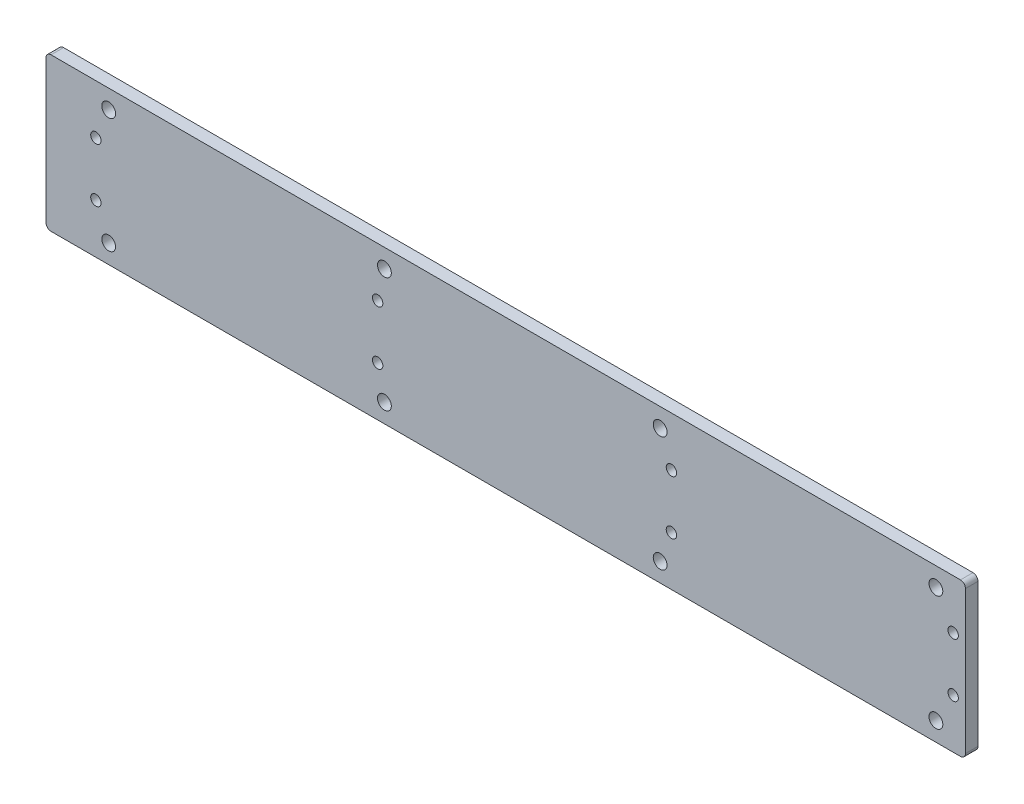
from build123d import *

# Parameters (mm, degrees)
SALIENTE_EXTRUIR1_DEPTH = 6.35
CROQUIS4_R              = 2.63125
CORTAR_EXTRUIR2_DEPTH   = 246.599940908
CROQUIS5_R              = 3.5000057
CORTAR_EXTRUIR3_DEPTH   = 246.599940908
REDONDEO1_R             = 2.54


with BuildPart() as part:
    # Croquis2 → Saliente-Extruir1 (new body)
    with BuildSketch(Plane.XY):
        Polygon((-242.443, -38.735), (-242.443, 38.735), (223.393, 38.735), (223.393, 19.685), (223.393, -19.685), (223.393, -38.735), align=None)
    extrude(amount=SALIENTE_EXTRUIR1_DEPTH)

    # Croquis4 → Cortar-Extruir2 (cut, through all)
    with BuildSketch(Plane.XY.offset(6.35)):
        with Locations((-217.17, 13.68025)):
            Circle(CROQUIS4_R)
        with Locations((-217.17, -13.68025)):
            Circle(CROQUIS4_R)
        with Locations(Location((217.17, -13.68025, 0), (0, 0, 180))):
            Circle(CROQUIS4_R)
        with Locations(Location((217.17, 13.68025, 0), (0, 0, 180))):
            Circle(CROQUIS4_R)
        with Locations((-74.422, 13.68025)):
            Circle(CROQUIS4_R)
        with Locations(Location((-74.422, -13.68025, 0), (0, 0, 180))):
            Circle(CROQUIS4_R)
        with Locations((74.422, 13.68025)):
            Circle(CROQUIS4_R)
        with Locations(Location((74.422, -13.68025, 0), (0, 0, 180))):
            Circle(CROQUIS4_R)
    extrude(amount=-CORTAR_EXTRUIR2_DEPTH, mode=Mode.SUBTRACT)

    # Croquis5 → Cortar-Extruir3 (cut, through all)
    with BuildSketch(Plane.XY.offset(6.35)):
        with Locations((-210.693, 29.21)):
            Circle(CROQUIS5_R)
        with Locations((-70.993, 29.21)):
            Circle(CROQUIS5_R)
        with Locations((68.707, 29.21)):
            Circle(CROQUIS5_R)
        with Locations((208.407, 29.21)):
            Circle(CROQUIS5_R)
        with Locations(Location((208.407, -29.21, 0), (0, 0, 180))):
            Circle(CROQUIS5_R)
        with Locations(Location((68.707, -29.21, 0), (0, 0, 180))):
            Circle(CROQUIS5_R)
        with Locations(Location((-70.993, -29.21, 0), (0, 0, 180))):
            Circle(CROQUIS5_R)
        with Locations(Location((-210.693, -29.21, 0), (0, 0, 180))):
            Circle(CROQUIS5_R)
    extrude(amount=-CORTAR_EXTRUIR3_DEPTH, mode=Mode.SUBTRACT)

    # Redondeo1
    redondeo1_edges = [part.edges().sort_by_distance(p)[0] for p in [
        (223.393, -38.735, 3.175),
        (-242.443, -38.735, 3.175),
        (-242.443, 38.735, 3.175),
        (223.393, 38.735, 3.175),
    ]]
    fillet(redondeo1_edges, radius=REDONDEO1_R)


solid = part.part
